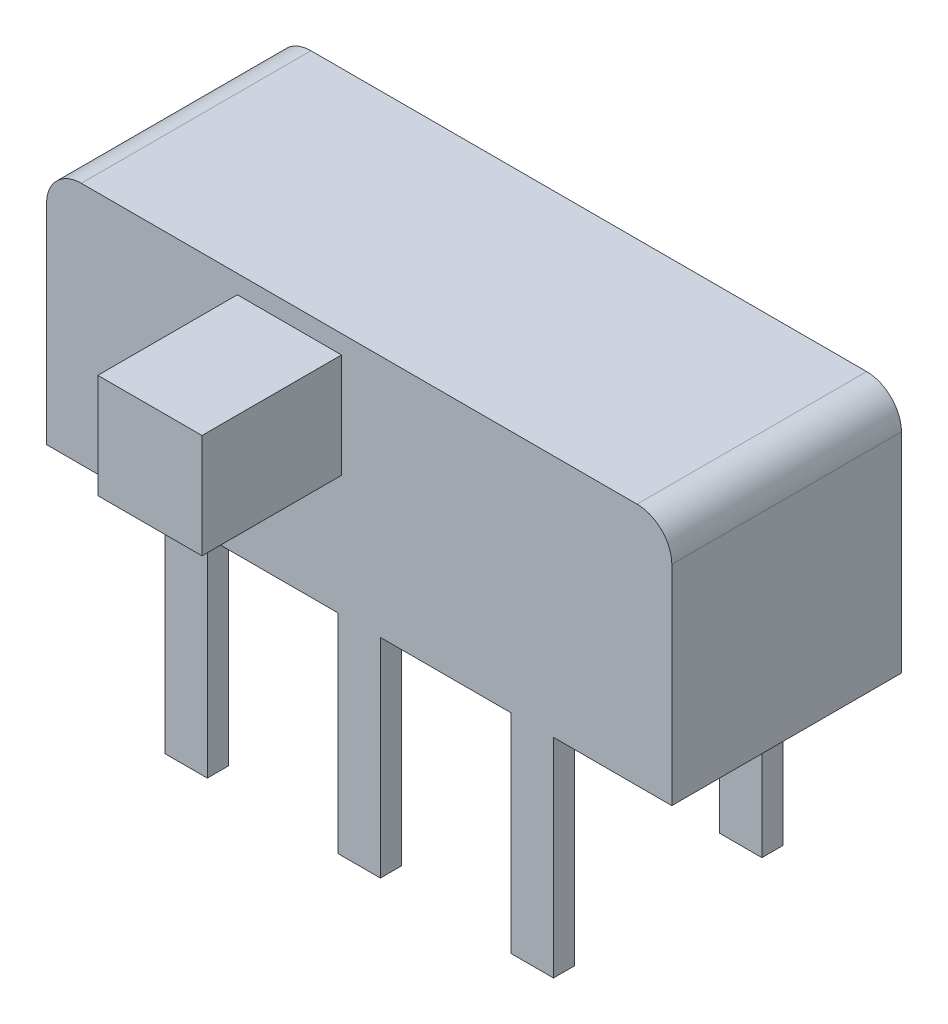
from build123d import *

# Parameters (mm, degrees)
SKETCH1_W               = 8.9916
SKETCH1_H               = 3.302
BOSS_EXTRUDE1_DEPTH     = 3.5052
SKETCH2_W               = 1.4986
SKETCH2_H               = 1.4986
BOSS_EXTRUDE2_DEPTH     = 2.0066
FILLET1_R               = 0.5
SKETCH3_W               = 0.6096
SKETCH3_H               = 0.3048
BOSS_EXTRUDE3_DEPTH     = 2.9972
LPATTERN1_COUNT         = 3
LPATTERN1_PITCH         = 2.4892
MIRROR6_COPY_1_SKETCH_W = 0.6096
MIRROR6_COPY_1_SKETCH_H = 0.3048
MIRROR6_COPY_1_DEPTH    = 2.9972
MIRROR6_COPY_2_SKETCH_W = 0.6096
MIRROR6_COPY_2_SKETCH_H = 0.3048
MIRROR6_COPY_2_DEPTH    = 2.9972


with BuildPart() as part:
    # Sketch1 → Boss-Extrude1 (new body)
    with BuildSketch(Plane(origin=(0, 0, 0), x_dir=(1, 0, 0), z_dir=(0, 1, 0))):
        Rectangle(SKETCH1_W, SKETCH1_H)
    extrude(amount=BOSS_EXTRUDE1_DEPTH)

    # Sketch2 → Boss-Extrude2 (add)
    with BuildSketch(Plane.XY.offset(1.651)):
        with Locations((-1.0033, 2.4892)):
            Rectangle(SKETCH2_W, SKETCH2_H)
    extrude(amount=BOSS_EXTRUDE2_DEPTH)

    # Fillet1
    fillet1_edges = [part.edges().sort_by_distance(p)[0] for p in [
        (4.4958, 3.5052, 0),
        (-4.4958, 3.5052, 0),
    ]]
    fillet(fillet1_edges, radius=FILLET1_R)

    # Sketch3 → Boss-Extrude3 (add)
    with BuildSketch(Plane.XZ):
        with Locations((2.4892, 1.4986)):
            Rectangle(SKETCH3_W, SKETCH3_H)
    boss_extrude3 = extrude(amount=BOSS_EXTRUDE3_DEPTH)

    # LPattern1: Boss-Extrude3 ×3
    with Locations(*[(-i * LPATTERN1_PITCH, 0, 0) for i in range(1, LPATTERN1_COUNT)]):
        add(boss_extrude3)

    # Mirror6: Boss-Extrude3 across plane
    add(boss_extrude3.mirror(Plane.XY))

    # Mirror6 copy 1 sketch → Mirror6 copy 1 (add)
    with BuildSketch(Plane(origin=(-2.4892, 0, 0), x_dir=(1, 0, 0), z_dir=(0, -1, 0))):
        with Locations((2.4892, -1.4986)):
            Rectangle(MIRROR6_COPY_1_SKETCH_W, MIRROR6_COPY_1_SKETCH_H)
    extrude(amount=MIRROR6_COPY_1_DEPTH)

    # Mirror6 copy 2 sketch → Mirror6 copy 2 (add)
    with BuildSketch(Plane(origin=(-4.9784, 0, 0), x_dir=(1, 0, 0), z_dir=(0, -1, 0))):
        with Locations((2.4892, -1.4986)):
            Rectangle(MIRROR6_COPY_2_SKETCH_W, MIRROR6_COPY_2_SKETCH_H)
    extrude(amount=MIRROR6_COPY_2_DEPTH)


solid = part.part
